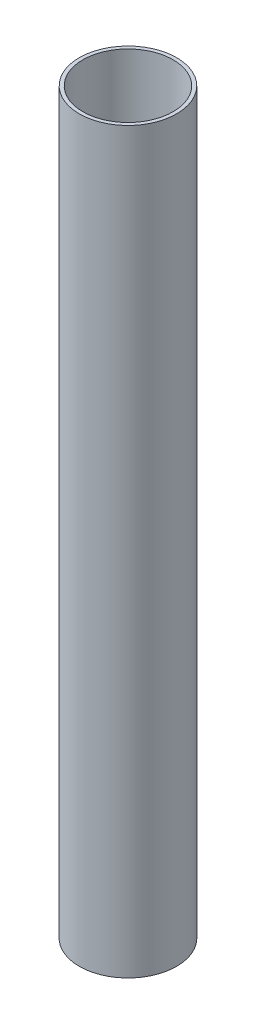
from build123d import *

# Parameters (mm, degrees)
SKETCH1_R           = 20.5
SKETCH1_R_2         = 19
BOSS_EXTRUDE1_DEPTH = 311


with BuildPart() as part:
    # Sketch1 → Boss-Extrude1 (new body)
    with BuildSketch(Plane(origin=(0, 0, 0), x_dir=(1, 0, 0), z_dir=(0, 1, 0))):
        with Locations(Location((0, 0, 0), (0, 0, 270))):
            Circle(SKETCH1_R)
        with Locations(Location((0, 0, 0), (0, 0, 270))):
            Circle(SKETCH1_R_2, mode=Mode.SUBTRACT)
    extrude(amount=BOSS_EXTRUDE1_DEPTH)


solid = part.part
